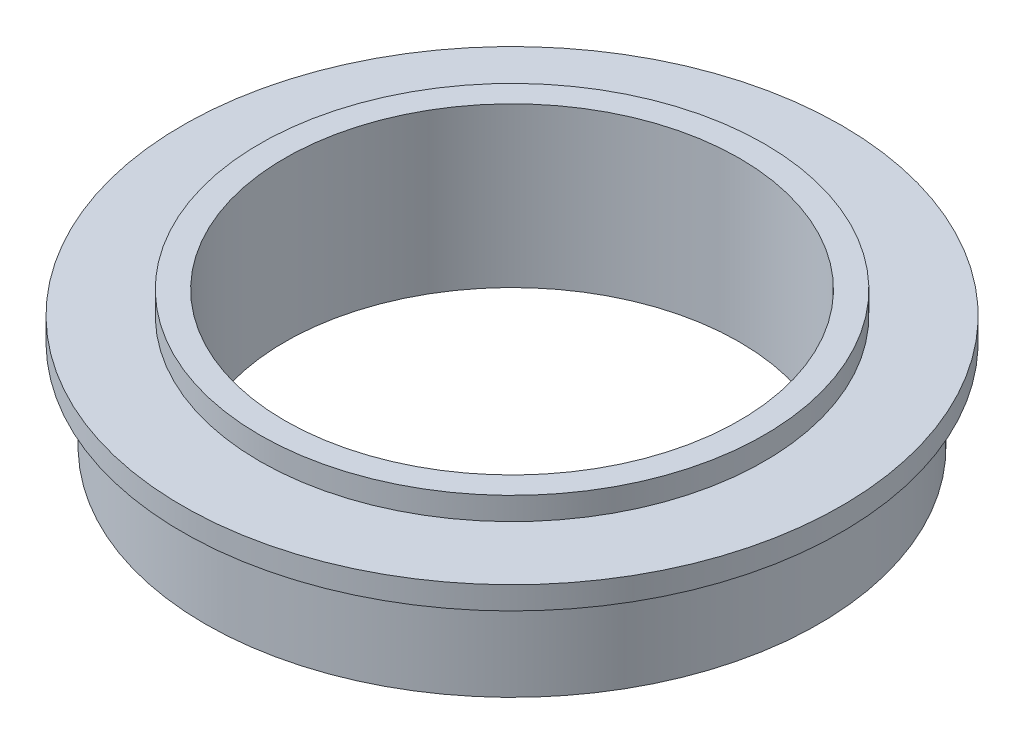
from build123d import *


with BuildPart() as part:
    # 草图1 → 旋转1 (revolve)
    with BuildSketch(Plane.XY, mode=Mode.PRIVATE) as revolve_1_sk:
        Polygon((11.1, 0), (13.5, 0), (13.5, 4), (14.5, 4), (14.5, 5), (11.1, 5), (11.1, 6), (10, 6), (10, -1), (11.1, -1), align=None)
    revolve(revolve_1_sk.sketch.rotate(Axis((0, 0, 0), (0, 1, 0)), 90), axis=Axis((0, 0, 0), (0, 1, 0)))


solid = part.part
